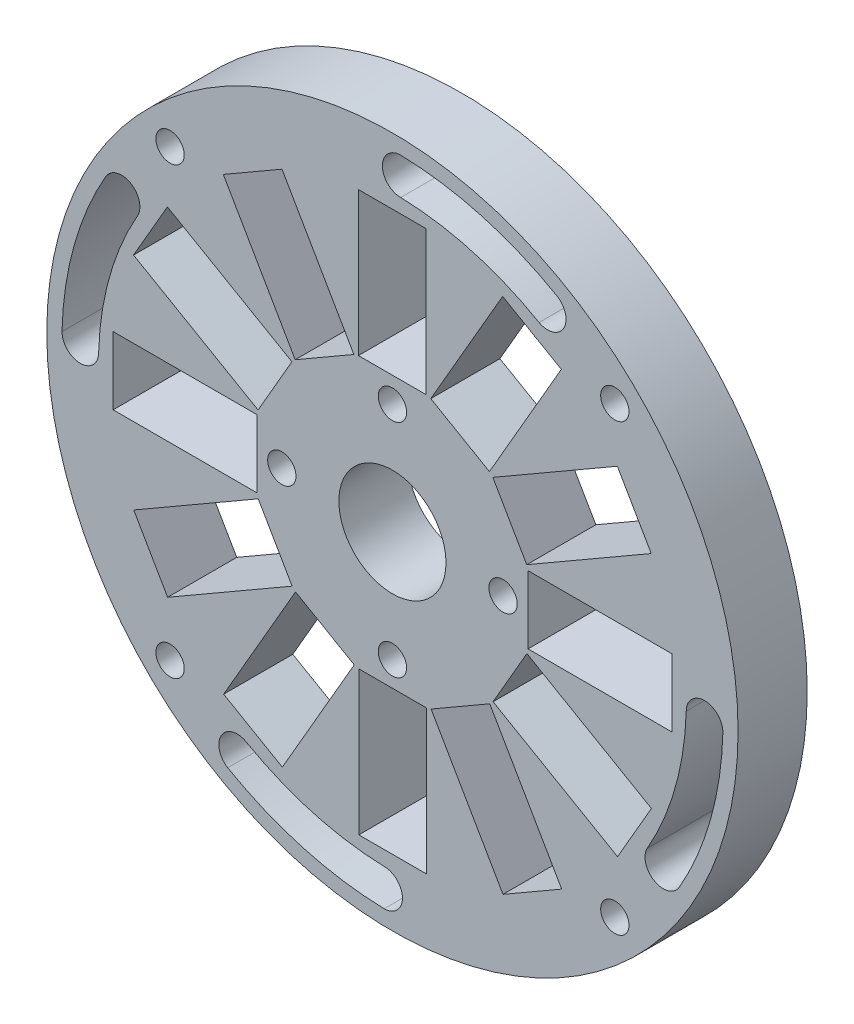
from build123d import *

# Parameters (mm, degrees)
CROQUIS2_R              = 50
SALIENTE_EXTRUIR1_DEPTH = 10
CROQUIS1_W              = 9.8
CROQUIS1_H              = 20.8
CROQUIS1_W_2            = 20.8
CROQUIS1_H_2            = 9.8
CORTAR_EXTRUIR3_DEPTH   = 72.414284285
CROQUIS4_R              = 7.75
CORTAR_EXTRUIR4_DEPTH   = 10
CROQUIS5_R              = 2.05
CORTAR_EXTRUIR5_DEPTH   = 10
CROQUIS6_R              = 2.05
CORTAR_EXTRUIR6_DEPTH   = 6


with BuildPart() as part:
    # Croquis2 → Saliente-Extruir1 (new body)
    with BuildSketch(Plane(origin=(0, 0, 0), x_dir=(0, 1, 0), z_dir=(0, 0, 1))):
        with Locations(Location((0, 0, 0), (0, 0, 270))):
            Circle(CROQUIS2_R)
    extrude(amount=SALIENTE_EXTRUIR1_DEPTH)

    # Croquis1 → Cortar-Extruir3 (cut, through all)
    with BuildSketch(Plane(origin=(0, 0, 0), x_dir=(0, 1, 0), z_dir=(0, 0, 1))):
        Polygon((15.964211374, 37.450825203), (5.564211374, 19.437496804), (14.051260331, 14.537496804), (24.451260331, 32.550825203), align=None)
        with Locations((0, 30)):
            Rectangle(CROQUIS1_W, CROQUIS1_H)
        Polygon((32.558561056, 24.464659221), (14.545232657, 14.064659221), (19.445232657, 5.577610264), (37.458561056, 15.977610264), align=None)
        with Locations((30.036606449, 0.021134743)):
            Rectangle(CROQUIS1_W_2, CROQUIS1_H_2)
        Polygon((37.487431651, -15.943076631), (19.474103253, -5.543076631), (14.574103253, -14.030125588), (32.587431651, -24.430125588), align=None)
        Polygon((24.50126567, -32.537426313), (14.10126567, -14.524097914), (5.614216713, -19.424097914), (16.014216713, -37.437426313), align=None)
        with Locations((0.057741191, -30.015471706)):
            Rectangle(CROQUIS1_W, CROQUIS1_H)
        Polygon((-15.906470183, -37.466296909), (-5.506470183, -19.45296851), (-13.99351914, -14.55296851), (-24.39351914, -32.566296909), align=None)
        Polygon((-32.500819864, -24.480130927), (-14.487491466, -14.080130927), (-19.387491466, -5.59308197), (-37.400819864, -15.99308197), align=None)
        with Locations((-29.978865257, -0.036606449)):
            Rectangle(CROQUIS1_W_2, CROQUIS1_H_2)
        Polygon((-37.42969046, 15.927604926), (-19.416362061, 5.527604926), (-14.516362061, 14.014653883), (-32.52969046, 24.414653883), align=None)
        Polygon((-24.443524479, 32.521954607), (-14.043524479, 14.508626209), (-5.556475521, 19.408626209), (-15.956475521, 37.421954607), align=None)
        with BuildLine():
            ThreePointArc((47.8, -1.200469891), (45.15, 1.449530109), (42.5, -1.200469891))
            ThreePointArc((42.5, -1.200469891), (40.916298266, -11.556282456), (36.848431426, -21.210474521))
            ThreePointArc((36.848431426, -21.210474521), (37.876754986, -24.76308434), (41.454989786, -23.827818822))
            ThreePointArc((41.454989786, -23.827818822), (46.039249889, -12.910019273), (47.8, -1.200469891))
        make_face()
        with BuildLine():
            ThreePointArc((1.200469891, 47.8), (-1.449530109, 45.15), (1.200469891, 42.5))
            ThreePointArc((1.200469891, 42.5), (11.556282456, 40.916298266), (21.210474521, 36.848431426))
            ThreePointArc((21.210474521, 36.848431426), (24.76308434, 37.876754986), (23.827818822, 41.454989786))
            ThreePointArc((23.827818822, 41.454989786), (12.910019273, 46.039249889), (1.200469891, 47.8))
        make_face()
        with BuildLine():
            ThreePointArc((-1.200469891, -47.8), (1.449530109, -45.15), (-1.200469891, -42.5))
            ThreePointArc((-1.200469891, -42.5), (-11.556282456, -40.916298266), (-21.210474521, -36.848431426))
            ThreePointArc((-21.210474521, -36.848431426), (-24.76308434, -37.876754986), (-23.827818822, -41.454989786))
            ThreePointArc((-23.827818822, -41.454989786), (-12.910019273, -46.039249889), (-1.200469891, -47.8))
        make_face()
        with BuildLine():
            ThreePointArc((-47.8, 1.200469891), (-45.15, -1.449530109), (-42.5, 1.200469891))
            ThreePointArc((-42.5, 1.200469891), (-40.916298266, 11.556282456), (-36.848431426, 21.210474521))
            ThreePointArc((-36.848431426, 21.210474521), (-37.876754986, 24.76308434), (-41.454989786, 23.827818822))
            ThreePointArc((-41.454989786, 23.827818822), (-46.039249889, 12.910019273), (-47.8, 1.200469891))
        make_face()
    extrude(amount=CORTAR_EXTRUIR3_DEPTH, mode=Mode.SUBTRACT)

    # Croquis4 → Cortar-Extruir4 (cut)
    with BuildSketch(Plane.XY.offset(10)):
        Circle(CROQUIS4_R)
    extrude(amount=-CORTAR_EXTRUIR4_DEPTH, mode=Mode.SUBTRACT)

    # Croquis5 → Cortar-Extruir5 (cut)
    with BuildSketch(Plane.XY.offset(10)):
        with Locations((0, 16)):
            Circle(CROQUIS5_R)
        with Locations((16, 0)):
            Circle(CROQUIS5_R)
        with Locations((0, -16)):
            Circle(CROQUIS5_R)
        with Locations((-16, 0)):
            Circle(CROQUIS5_R)
    extrude(amount=-CORTAR_EXTRUIR5_DEPTH, mode=Mode.SUBTRACT)

    # Croquis6 → Cortar-Extruir6 (cut)
    with BuildSketch(Plane.XY.offset(10)):
        with Locations((-32.17, 32.17)):
            Circle(CROQUIS6_R)
        with Locations((32.17, 32.17)):
            Circle(CROQUIS6_R)
        with Locations((32.17, -32.17)):
            Circle(CROQUIS6_R)
        with Locations((-32.17, -32.17)):
            Circle(CROQUIS6_R)
    extrude(amount=-CORTAR_EXTRUIR6_DEPTH, mode=Mode.SUBTRACT)


solid = part.part
